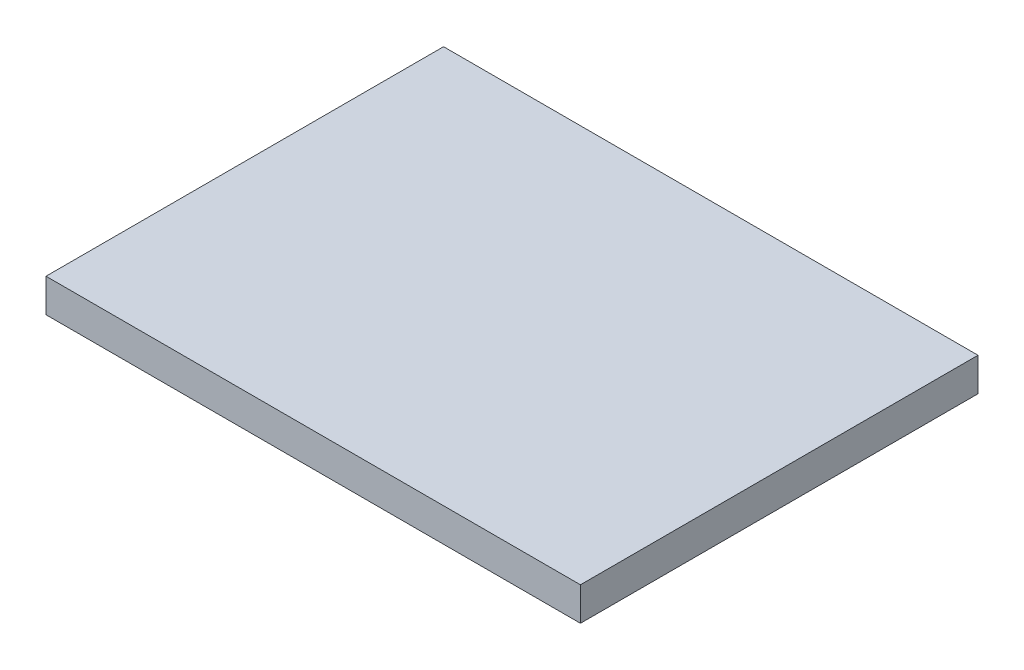
from build123d import *

# Parameters (mm, degrees)
SKETCH1_W           = 101.689482854
SKETCH1_H           = 75.647054318
BOSS_EXTRUDE1_DEPTH = 6.35


with BuildPart() as part:
    # Sketch1 → Boss-Extrude1 (new body)
    with BuildSketch(Plane(origin=(0, 0, 0), x_dir=(1, 0, 0), z_dir=(0, 1, 0))):
        with Locations((50.844741427, 37.823527159)):
            Rectangle(SKETCH1_W, SKETCH1_H)
    extrude(amount=BOSS_EXTRUDE1_DEPTH)


solid = part.part
